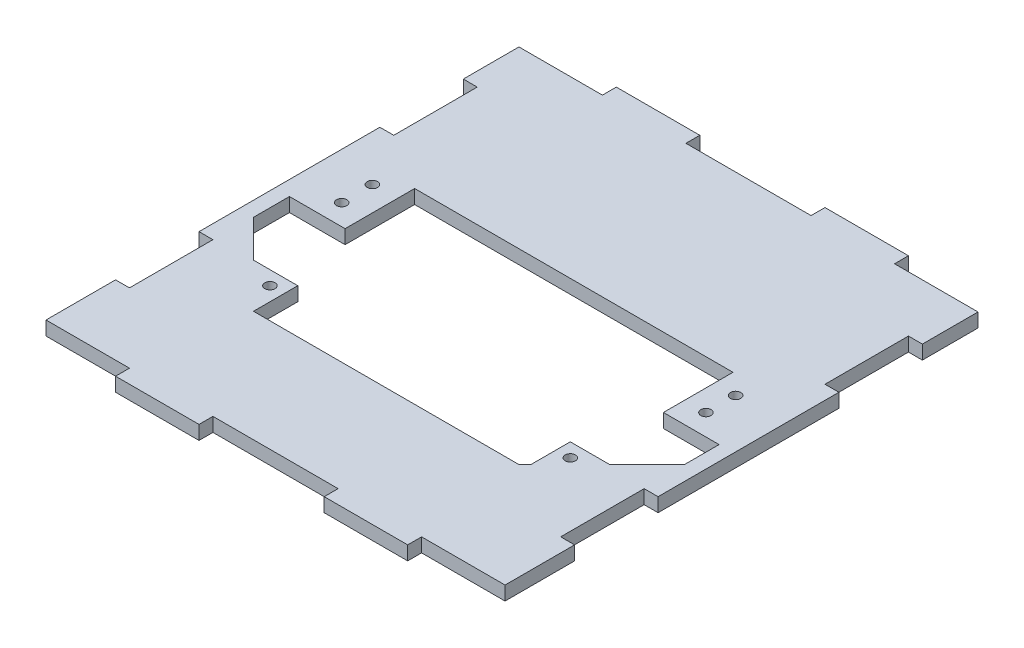
from build123d import *

# Parameters (mm, degrees)
BOSS_EXTRUDE1_DEPTH = 5
SKETCH3_R           = 1.85399934
CUT_EXTRUDE1_DEPTH  = 10


with BuildPart() as part:
    # Sketch1 → Boss-Extrude1 (new body)
    with BuildSketch(Plane(origin=(0, 0, 0), x_dir=(1, 0, 0), z_dir=(0, 1, 0))):
        Polygon((-42.454197946, 56.361544115), (-42.454197946, 51.361544115), (-72.454197946, 51.361544115), (-72.454197946, 31.361544115), (-67.454197946, 31.361544115), (-67.454197946, 1.361544115), (-72.454197946, 1.361544115), (-72.454197946, -63.638455885), (-67.454197946, -63.638455885), (-67.454197946, -93.638455885), (-72.454197946, -93.638455885), (-72.454197946, -118.638455885), (-42.454197946, -118.638455885), (-42.454197946, -123.638455885), (-12.454197946, -123.638455885), (-12.454197946, -118.638455885), (32.545802054, -118.638455885), (32.545802054, -123.638455885), (62.545802054, -123.638455885), (62.545802054, -118.638455885), (92.545802054, -118.638455885), (92.545802054, -93.638455885), (87.545802054, -93.638455885), (87.545802054, -63.638455885), (92.545802054, -63.638455885), (92.545802054, 1.361544115), (87.545802054, 1.361544115), (87.545802054, 31.361544115), (92.545802054, 31.361544115), (92.545802054, 51.361544115), (62.545802054, 51.361544115), (62.545802054, 56.361544115), (32.545802054, 56.361544115), (32.545802054, 51.361544115), (-12.454197946, 51.361544115), (-12.454197946, 56.361544115), align=None)
    extrude(amount=BOSS_EXTRUDE1_DEPTH)

    # Sketch3 → Cut-Extrude1 (cut)
    with BuildSketch(Plane(origin=(0, 5, 0), x_dir=(1, 0, 0), z_dir=(0, 1, 0))):
        Polygon((87.295802054, -48.920455885), (87.295802054, -36.455455885), (67.295802054, -36.455455885), (67.295802054, -11.455455885), (-47.136197946, -11.455455885), (-47.136197946, -36.455455885), (-67.136197946, -36.455455885), (-67.136197946, -49.301455885), (-53.721197946, -62.716455885), (-37.879197946, -62.716455885), (-37.879197946, -78.558455885), (-37.799197946, -78.638455885), (57.577802054, -78.638455885), (59.689802054, -76.526455885), (59.689802054, -62.335455885), (73.880802054, -62.335455885), align=None)
        with Locations(Location((-42.879197946, -67.716455885, 0), (0, 0, 270))):
            Circle(SKETCH3_R)
        with Locations(Location((-55.960197946, -17.805455885, 0), (0, 0, 270))):
            Circle(SKETCH3_R)
        with Locations(Location((-55.833197946, -28.981455885, 0), (0, 0, 270))):
            Circle(SKETCH3_R)
        with Locations(Location((64.689802054, -67.335455885, 0), (0, 0, 270))):
            Circle(SKETCH3_R)
        with Locations(Location((74.976802054, -18.186455885, 0), (0, 0, 270))):
            Circle(SKETCH3_R)
        with Locations(Location((74.976802054, -28.854455885, 0), (0, 0, 270))):
            Circle(SKETCH3_R)
    extrude(amount=-CUT_EXTRUDE1_DEPTH, mode=Mode.SUBTRACT)


solid = part.part
